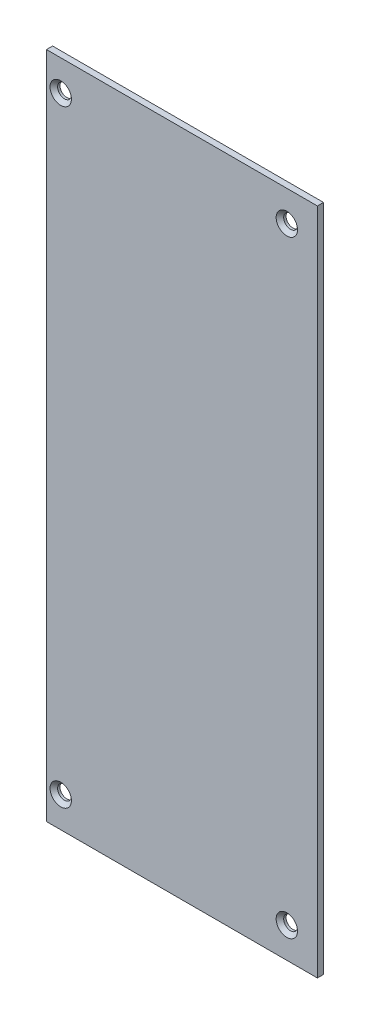
from build123d import *

# Parameters (mm, degrees)
SKETCH1_W                      = 84.401025
SKETCH1_H                      = 208.28
BOSS_EXTRUDE1_DEPTH            = 1.905
F_6_CLEARANCE_HOLE1_AT_2_COUNT = 2
F_6_CLEARANCE_HOLE1_AT_2_PITCH = 189.23
F_6_CLEARANCE_HOLE1_AT_3_COUNT = 2
F_6_CLEARANCE_HOLE1_AT_3_PITCH = 201.912164523
F_6_CLEARANCE_HOLE1_AT_4_COUNT = 2
F_6_CLEARANCE_HOLE1_AT_4_PITCH = 70.431025
SKETCH4_W                      = 8.466667
SKETCH4_H                      = 8.466667
BOSS_EXTRUDE2_DEPTH            = 9.525
CUT_EXTRUDE3_DEPTH             = 6.35
CHAMFER1_SIZE                  = 0.635


with BuildPart() as part:
    # Sketch1 → Boss-Extrude1 (new body)
    with BuildSketch(Plane.XY):
        Rectangle(SKETCH1_W, SKETCH1_H)
    extrude(amount=BOSS_EXTRUDE1_DEPTH)

    # Sketch3 → #6 Clearance Hole1 (revolve, cut)
    with BuildSketch(Plane(origin=(-37.7555125, 94.615, 1.905), x_dir=(0, -1, 0), z_dir=(1, 0, 0))):
        Polygon((0, 0), (0, 1.905), (2.15265, 1.905), (2.15265, 1.17475), (3.3274, 0), align=None)
    f_6_clearance_hole1 = revolve(axis=Axis((-37.7555125, 94.615, 8.255), (0, 0, -1)), mode=Mode.SUBTRACT)

    # #6 Clearance Hole1 at 2: #6 Clearance Hole1 ×2
    with Locations(*[(0, -i * F_6_CLEARANCE_HOLE1_AT_2_PITCH, 0) for i in range(1, F_6_CLEARANCE_HOLE1_AT_2_COUNT)]):
        add(f_6_clearance_hole1, mode=Mode.SUBTRACT)

    # #6 Clearance Hole1 at 3: #6 Clearance Hole1 ×2
    with Locations(*[Vector(0.34882011772903904, -0.9371896955619494, 0) * (i * F_6_CLEARANCE_HOLE1_AT_3_PITCH) for i in range(1, F_6_CLEARANCE_HOLE1_AT_3_COUNT)]):
        add(f_6_clearance_hole1, mode=Mode.SUBTRACT)

    # #6 Clearance Hole1 at 4: #6 Clearance Hole1 ×2
    with Locations(*[(i * F_6_CLEARANCE_HOLE1_AT_4_PITCH, 0, 0) for i in range(1, F_6_CLEARANCE_HOLE1_AT_4_COUNT)]):
        add(f_6_clearance_hole1, mode=Mode.SUBTRACT)

    # Sketch4 → Boss-Extrude2 (add)
    with BuildSketch(Plane(origin=(0, 0, 0), x_dir=(-1, 0, 0), z_dir=(0, 0, -1))):
        with Locations((37.967179, -8.0433335)):
            Rectangle(SKETCH4_W, SKETCH4_H)
        with Locations((37.967179, -82.973333082)):
            Rectangle(SKETCH4_W, SKETCH4_H)
    extrude(amount=BOSS_EXTRUDE2_DEPTH)

    # Sketch5 → Cut-Extrude3 (cut)
    with BuildSketch(Plane(origin=(-42.2005125, 0, 0), x_dir=(0, 0, -1), z_dir=(1, 0, 0))):
        Polygon((2.116666667, -82.973333082), (5.291666667, -79.798333082), (8.466666667, -82.973333082), (5.291666667, -86.148333082), align=None)
        Polygon((2.116666667, -8.0433335), (5.291666667, -4.8683335), (8.466666667, -8.0433335), (5.291666667, -11.2183335), align=None)
    extrude(amount=CUT_EXTRUDE3_DEPTH, mode=Mode.SUBTRACT)

    # Chamfer1
    chamfer1_edges = [part.edges().sort_by_distance(p)[0] for p in [
        (-42.2005125, -84.560833082, -3.704166667),
        (-42.2005125, -84.560833082, -6.879166667),
        (-42.2005125, -81.385833082, -6.879166667),
        (-42.2005125, -81.385833082, -3.704166667),
        (-35.8505125, -84.560833082, -3.704166667),
        (-35.8505125, -84.560833082, -6.879166667),
        (-35.8505125, -81.385833082, -6.879166667),
        (-35.8505125, -81.385833082, -3.704166667),
        (-42.2005125, -9.6308335, -3.704166667),
        (-42.2005125, -9.6308335, -6.879166667),
        (-42.2005125, -6.4558335, -6.879166667),
        (-42.2005125, -6.4558335, -3.704166667),
        (-35.8505125, -9.6308335, -3.704166667),
        (-35.8505125, -9.6308335, -6.879166667),
        (-35.8505125, -6.4558335, -6.879166667),
        (-35.8505125, -6.4558335, -3.704166667),
    ]]
    chamfer(chamfer1_edges, length=CHAMFER1_SIZE)


solid = part.part
